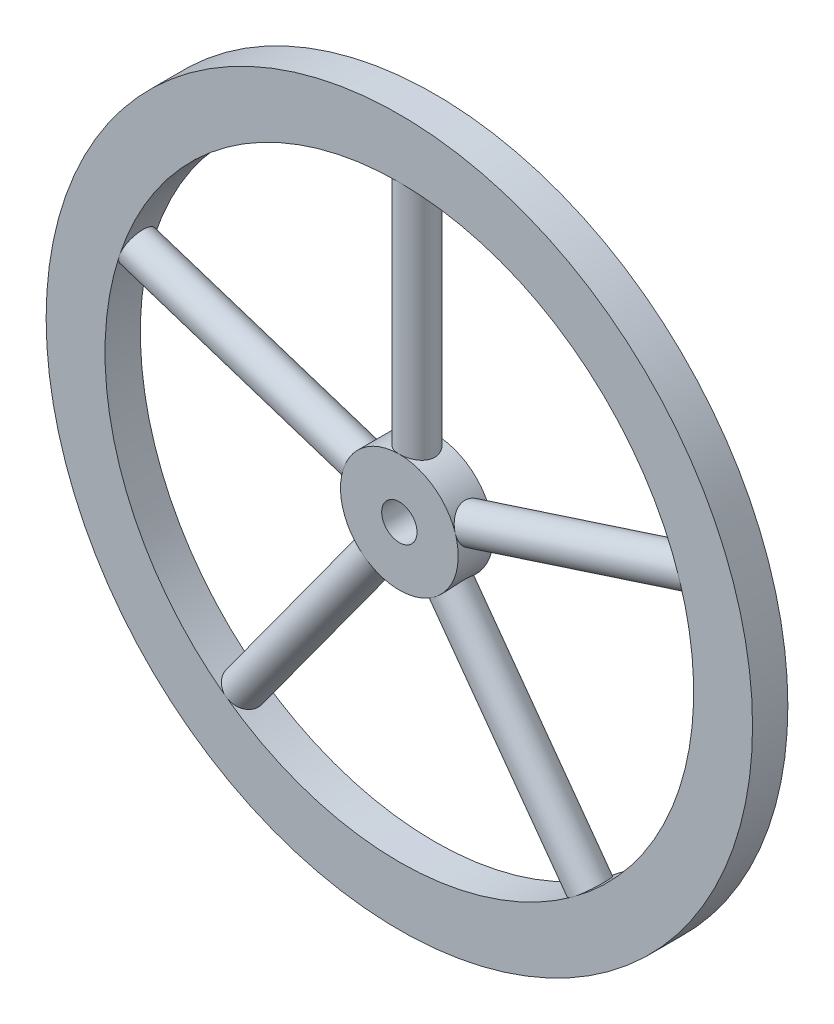
from build123d import *

# Parameters (mm, degrees)
SKETCH1_R             = 300
SKETCH1_R_2           = 250
BOSS_EXTRUDE1_DEPTH   = 15
SKETCH1_R_3           = 50
SKETCH1_R_4           = 15
BOSS_EXTRUDE1_2_DEPTH = 15
SKETCH3_W             = 15
SKETCH3_H             = 226.328487882
CIRPATTERN1_COUNT     = 5


with BuildPart() as part:
    # Sketch1 → Boss-Extrude1 (new, symmetric)
    with BuildSketch(Plane.XY):
        Circle(SKETCH1_R)
        Circle(SKETCH1_R_2, mode=Mode.SUBTRACT)
    extrude(amount=BOSS_EXTRUDE1_DEPTH, both=True)



with BuildPart() as body_2:
    # Sketch1 → Boss-Extrude1 2 (new, symmetric)
    with BuildSketch(Plane.XY):
        Circle(SKETCH1_R_3)
        Circle(SKETCH1_R_4, mode=Mode.SUBTRACT)
    extrude(amount=BOSS_EXTRUDE1_2_DEPTH, both=True)


with BuildPart() as part_1:
    add(part.part)

    add(body_2.part)  # Revolve1 merges body 2
    # Sketch3 → Revolve1 (revolve)
    with BuildSketch(Plane.XY, mode=Mode.PRIVATE) as revolve1_sk:
        with Locations((7.5, 150.074025738)):
            Rectangle(SKETCH3_W, SKETCH3_H)
    revolve1 = revolve(revolve1_sk.sketch.rotate(Axis((0, 0, 0), (0, 1, 0)), 90), axis=Axis((0, 0, 0), (0, 1, 0)))

    # CirPattern1: Revolve1 ×5 about axis
    cirpattern1_axis = Axis((0, 0, 15), (0, 0, -1))
    for i in range(1, CIRPATTERN1_COUNT):
        add(revolve1.rotate(cirpattern1_axis, i * 360 / CIRPATTERN1_COUNT))


solid = part_1.part
